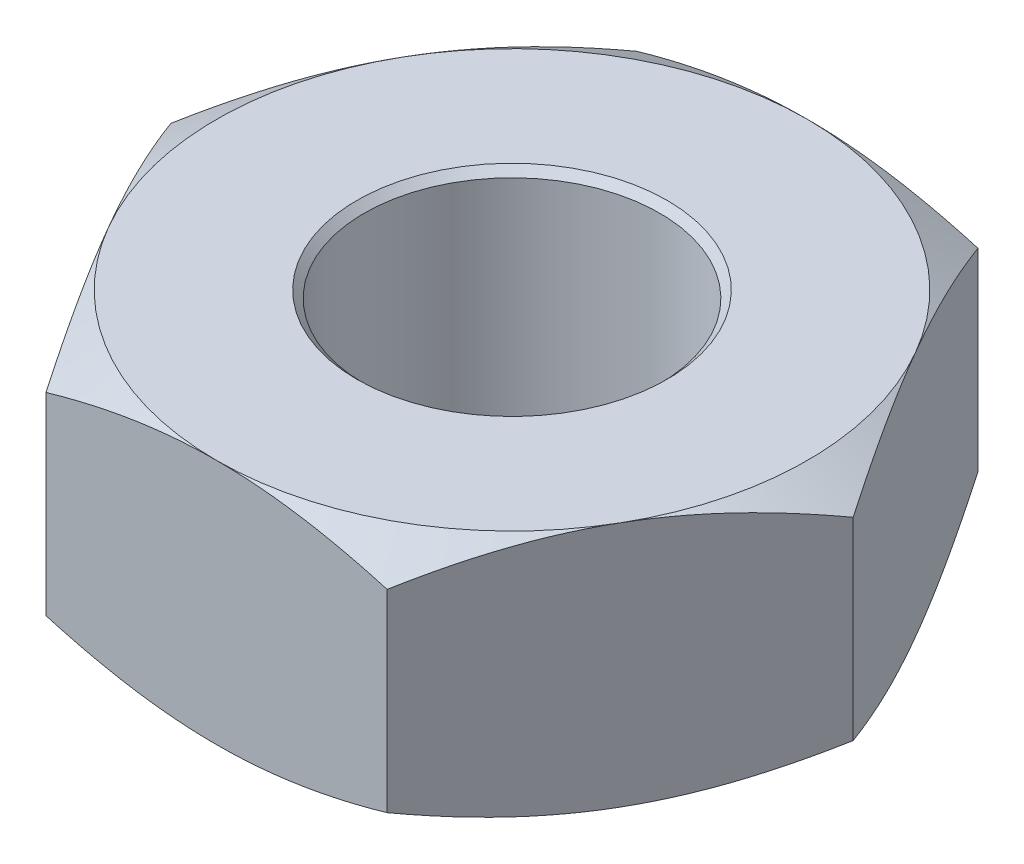
from build123d import *

# Parameters (mm, degrees)
SKETCH2_R           = 1.5
BOSS_EXTRUDE1_DEPTH = 2.5
SKETCH3_OUTSIDE_W   = 22.086
SKETCH3_OUTSIDE_H   = 21.158
SKETCH3_OUTSIDE_R   = 3
CUT_EXTRUDE1_DEPTH  = 3.25
CUT_EXTRUDE1_DRAFT  = 60
SKETCH4_OUTSIDE_W   = 22.086
SKETCH4_OUTSIDE_H   = 21.158
SKETCH4_OUTSIDE_R   = 3
CUT_EXTRUDE2_DEPTH  = 3.25
CUT_EXTRUDE2_DRAFT  = -60
CHAMFER1_SIZE       = 0.075


with BuildPart() as part:
    # Sketch2 → Boss-Extrude1 (new body)
    with BuildSketch(Plane(origin=(0, 0, 0), x_dir=(1, 0, 0), z_dir=(0, 1, 0))):
        Polygon((3.464101615, 0), (1.732050808, 3), (-1.732050808, 3), (-3.464101615, 0), (-1.732050808, -3), (1.732050808, -3), align=None)
        with Locations(Location((0, 0, 0), (0, 0, 270))):
            Circle(SKETCH2_R, mode=Mode.SUBTRACT)
    extrude(amount=BOSS_EXTRUDE1_DEPTH)


with BuildPart() as cut_extrude1_tool:
    # Sketch3 outside → Cut-Extrude1 (with draft: the straight prism first)
    with BuildSketch(Plane(origin=(0, 0, 0), x_dir=(1, 0, 0), z_dir=(0, 1, 0))):
        Rectangle(SKETCH3_OUTSIDE_W, SKETCH3_OUTSIDE_H)
        Circle(SKETCH3_OUTSIDE_R, mode=Mode.SUBTRACT)
    extrude(amount=CUT_EXTRUDE1_DEPTH)
    # Cut-Extrude1: the draft: its side faces are tilted about the plane it starts from
    cut_extrude1_sides = [cut_extrude1_tool.faces().sort_by_distance(p)[0] for p in [
        (0, 1.625, 10.579),
        (11.043, 1.625, 0),
        (0, 1.625, -10.579),
        (-11.043, 1.625, 0),
        (-3, 1.625, 0),
    ]]
    draft(cut_extrude1_sides, Plane(origin=(0, 0, 0), x_dir=(1, 0, 0), z_dir=(0, 1, 0)), CUT_EXTRUDE1_DRAFT)


with BuildPart() as part_1:
    add(part.part)

    # Cut-Extrude1: cut by cut_extrude1_tool
    add(cut_extrude1_tool.part, mode=Mode.SUBTRACT)


with BuildPart() as cut_extrude2_tool:
    # Sketch4 outside → Cut-Extrude2 (with draft: the straight prism first)
    with BuildSketch(Plane(origin=(0, 2.5, 0), x_dir=(1, 0, 0), z_dir=(0, 1, 0))):
        Rectangle(SKETCH4_OUTSIDE_W, SKETCH4_OUTSIDE_H)
        Circle(SKETCH4_OUTSIDE_R, mode=Mode.SUBTRACT)
    extrude(amount=-CUT_EXTRUDE2_DEPTH)
    # Cut-Extrude2: the draft: its side faces are tilted about the plane it starts from
    cut_extrude2_sides = [cut_extrude2_tool.faces().sort_by_distance(p)[0] for p in [
        (0, 0.875, 10.579),
        (11.043, 0.875, 0),
        (0, 0.875, -10.579),
        (-11.043, 0.875, 0),
        (-3, 0.875, 0),
    ]]
    draft(cut_extrude2_sides, Plane(origin=(0, 2.5, 0), x_dir=(1, 0, 0), z_dir=(0, 1, 0)), CUT_EXTRUDE2_DRAFT)


with BuildPart() as part_2:
    add(part_1.part)

    # Cut-Extrude2: cut by cut_extrude2_tool
    add(cut_extrude2_tool.part, mode=Mode.SUBTRACT)

    # Chamfer1
    chamfer1_edges = [part_2.edges().sort_by_distance(p)[0] for p in [
        (0, 0, -1.5),
        (0, 2.5, -1.5),
    ]]
    chamfer(chamfer1_edges, length=CHAMFER1_SIZE)


solid = part_2.part
